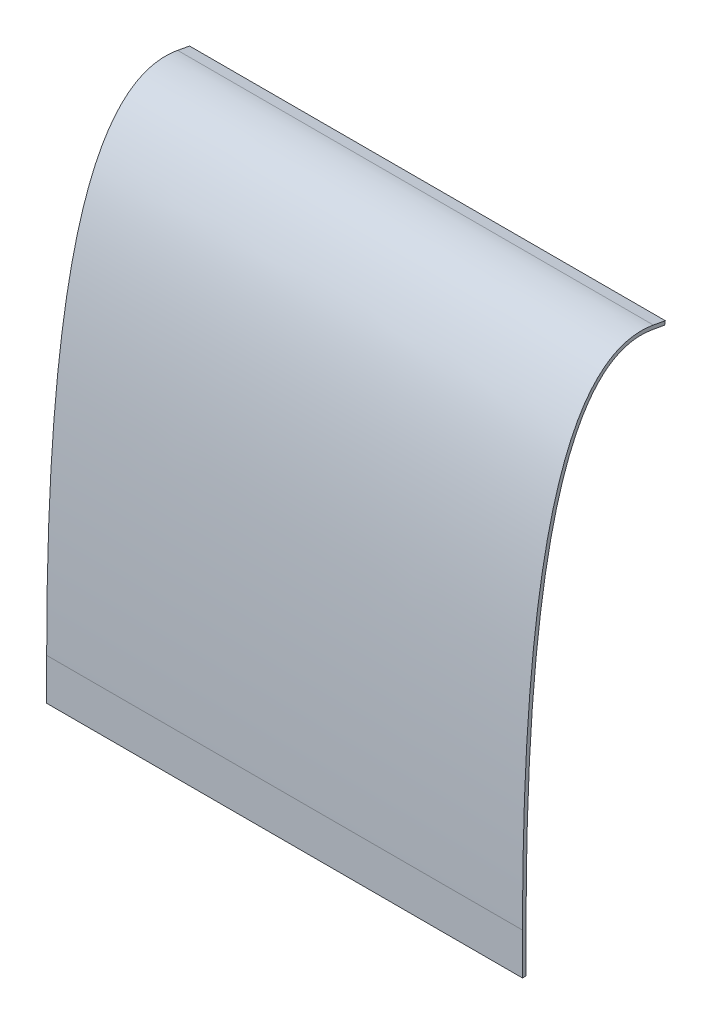
from build123d import *

# Parameters (mm, degrees)
SKETCH1_W           = 418.07892
SKETCH1_H           = 36.484920898
BOSS_EXTRUDE1_DEPTH = 3.175


with BuildPart() as part:
    # Sketch1 → Boss-Extrude1 (new body)
    with BuildSketch(Plane.XY):
        with Locations((209.03946, -5356.411291394)):
            Rectangle(SKETCH1_W, SKETCH1_H)
    extrude(amount=BOSS_EXTRUDE1_DEPTH)

    # Sweep1: sweep along a curve in space
    with BuildLine() as sweep1_path:
        Line((418.07892, -5338.168830945, 0), (0, -5338.168830945, 0))
    # Sketch7 → Sweep1 (sweep)
    with BuildSketch(Plane.ZY):
        with BuildLine():
            Line((-111.330615302, -4938.421114276), (-121.798132423, -4940.338680499))
            Line((-121.798132423, -4940.338680499), (-122.370246605, -4937.215651463))
            Line((-122.370246605, -4937.215651463), (-111.902729484, -4935.298085239))
            add(Edge.make_bspline(
                [(3.175, -5338.168830945), (3.175, -5335.987340768), (3.170465411, -5331.611375202), (3.143256962, -5322.963354035), (3.075233484, -5312.276385749), (2.939178486, -5299.671407322), (2.685193541, -5283.149253537), (2.231609699, -5263.033587898), (1.469474893, -5239.752652062), (0.489420195, -5217.329633102), (-1.108022954, -5188.575658793), (-3.650209462, -5154.776275246), (-7.574872597, -5117.642633017), (-12.375948375, -5083.930165151), (-18.056948382, -5053.632874569), (-26.814336297, -5017.779310899), (-37.360530821, -4988.718612896), (-49.795766977, -4966.398851204), (-60.121348091, -4953.027343833), (-71.513011288, -4943.058713533), (-81.923670653, -4937.680846083), (-90.753377806, -4935.206562348), (-97.597956352, -4934.271610019), (-103.474595102, -4934.259450376), (-108.25392015, -4934.701542264), (-110.696774931, -4935.077163917), (-111.902729484, -4935.298085239)],
                knots=[0.490445447, 0.490445447, 0.490445447, 0.490445447, 0.490528714, 0.490611981, 0.490778515, 0.490945049, 0.491111583, 0.491444651, 0.49177772, 0.492110788, 0.492443856, 0.493109992, 0.493776128, 0.494442265, 0.495108401, 0.495774537, 0.49710681, 0.497772946, 0.498439083, 0.499105219, 0.499771355, 0.500104423, 0.500437491, 0.50077056, 0.500937094, 0.501103628, 0.501103628, 0.501103628, 0.501103628], degree=3))
            Line((3.175, -5338.168830945), (0, -5338.168830945))
            add(Edge.make_bspline(
                [(0, -5338.168830945), (0, -4918.026227399), (-111.330615302, -4938.421114276)],
                knots=[0, 0, 0, 1, 1, 1], degree=2))
        make_face()
    sweep(path=sweep1_path.line)


solid = part.part
